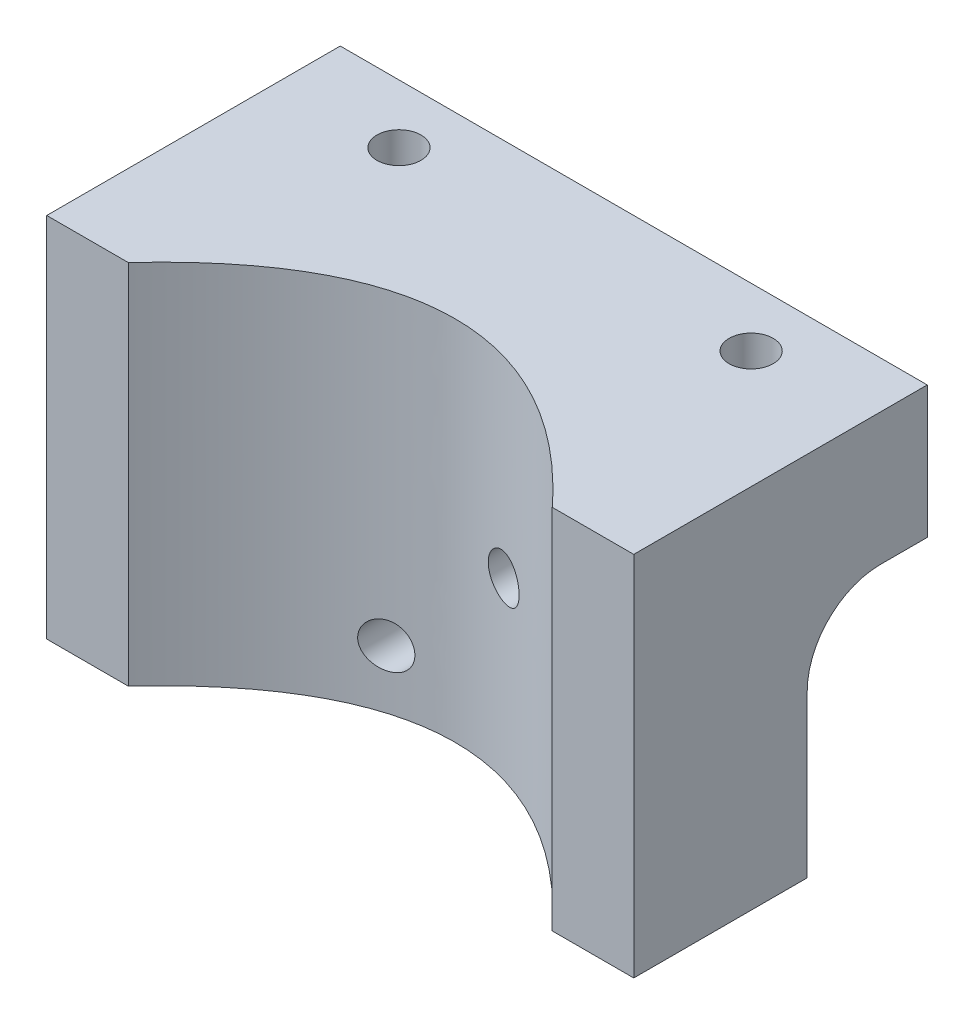
from build123d import *

# Parameters (mm, degrees)
BOSS_EXTRUDE1_DEPTH     = 25
SKETCH2_W               = 40
SKETCH2_H               = 9
BOSS_EXTRUDE2_DEPTH     = 8.18
FILLET1_R               = 5
CUT_EXTRUDE1_DEPTH      = 45.172054958
CUT_EXTRUDE1_DEPTH_BACK = 45.172054958
SKETCH3_R               = 1.5
SKETCH3_3_R             = 3.75
CUT_EXTRUDE2_DEPTH      = 45.172054958
SKETCH4_R               = 1.5
CUT_EXTRUDE3_DEPTH      = 48.026142101
CUT_EXTRUDE9_START      = -9
SKETCH4_4_R             = 4
CUT_EXTRUDE9_DEPTH      = 39.026142101


with BuildPart() as part:
    # Sketch1 → Boss-Extrude1 (new body)
    with BuildSketch(Plane(origin=(0, 0, 0), x_dir=(1, 0, 0), z_dir=(0, 1, 0))):
        with BuildLine():
            Line((0, 0), (-5.555, 0))
            Line((-5.555, 0), (-5.555, 11.82))
            Line((-5.555, 11.82), (15.89, 11.82))
            Line((15.89, 11.82), (34.445, 11.82))
            Line((34.445, 11.82), (34.445, 0))
            Line((34.445, 0), (28.89, 0))
            add(Edge.make_bspline(
                [(0, 0), (14.445, 15.64), (28.89, 0)],
                knots=[0, 0, 0, 1, 1, 1], degree=2))
        make_face()
    extrude(amount=BOSS_EXTRUDE1_DEPTH)

    # Sketch2 → Boss-Extrude2 (add)
    with BuildSketch(Plane(origin=(0, 0, -11.82), x_dir=(-1, 0, 0), z_dir=(0, 0, -1))):
        with Locations((-14.445, 20.5)):
            Rectangle(SKETCH2_W, SKETCH2_H)
    extrude(amount=BOSS_EXTRUDE2_DEPTH)

    # Fillet1
    fillet1_edges = [part.edges().sort_by_distance(p)[0] for p in [
        (14.445, 16, -11.82),
    ]]
    fillet(fillet1_edges, radius=FILLET1_R)

    # Sketch3 → Cut-Extrude1 (cut, two sides: drawn at the far end of the back side and taken through both)
    with BuildSketch(Plane(origin=(0, 0, -11.82), x_dir=(-1, 0, 0), z_dir=(0, 0, -1)).offset(-CUT_EXTRUDE1_DEPTH_BACK)):
        with Locations((-10.445, 4)):
            Circle(SKETCH3_R)
        with Locations((-18.445, 12)):
            Circle(SKETCH3_R)
    extrude(amount=CUT_EXTRUDE1_DEPTH + CUT_EXTRUDE1_DEPTH_BACK, mode=Mode.SUBTRACT)

    # Sketch3<3> → Cut-Extrude2 (cut, through all)
    with BuildSketch(Plane(origin=(0, 0, -11.82), x_dir=(-1, 0, 0), z_dir=(0, 0, -1))):
        with Locations((-18.445, 12)):
            Circle(SKETCH3_3_R)
    extrude(amount=CUT_EXTRUDE2_DEPTH, mode=Mode.SUBTRACT)

    # Sketch4 → Cut-Extrude3 (cut, through all)
    with BuildSketch(Plane(origin=(0, 25, 0), x_dir=(1, 0, 0), z_dir=(0, 1, 0))):
        with Locations(Location((26.445, 16, 0), (0, 0, 270))):
            Circle(SKETCH4_R)
        with Locations(Location((2.445, 16, 0), (0, 0, 270))):
            Circle(SKETCH4_R)
    extrude(amount=-CUT_EXTRUDE3_DEPTH, mode=Mode.SUBTRACT)

    # Sketch4<4> → Cut-Extrude9 (cut, through all)
    with BuildSketch(Plane(origin=(0, 25, 0), x_dir=(1, 0, 0), z_dir=(0, 1, 0)).offset(CUT_EXTRUDE9_START)):
        with Locations((26.445, 16)):
            Circle(SKETCH4_4_R)
        with Locations((2.445, 16)):
            Circle(SKETCH4_4_R)
    extrude(amount=-CUT_EXTRUDE9_DEPTH, mode=Mode.SUBTRACT)


solid = part.part
